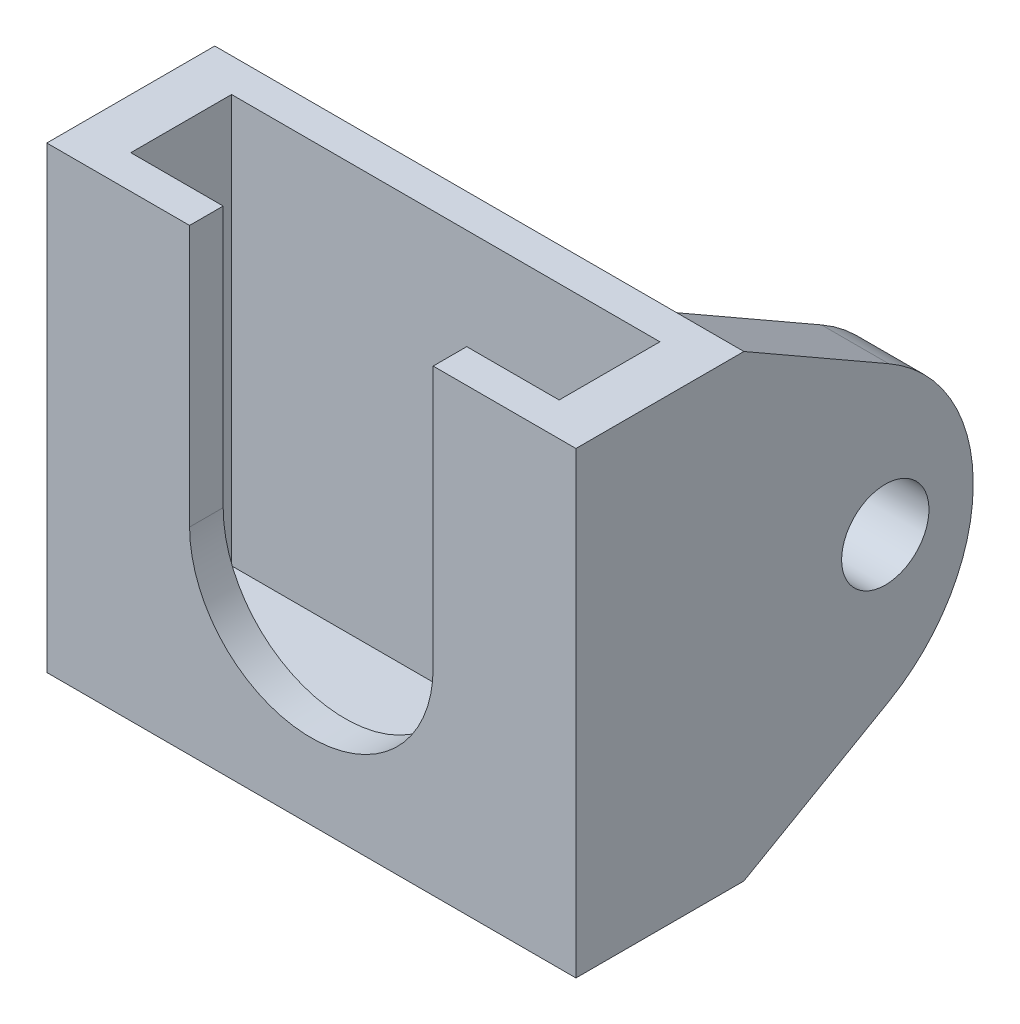
from build123d import *

# Parameters (mm, degrees)
SKETCH1_W           = 31.5
SKETCH1_H           = 30.3
SKETCH1_W_2         = 25.5
SKETCH1_H_2         = 24.3
BOSS_EXTRUDE1_DEPTH = 6
SKETCH2_W           = 31.5
SKETCH2_H           = 30.3
BOSS_EXTRUDE2_DEPTH = 2
CUT_EXTRUDE1_DEPTH  = 61
BOSS_EXTRUDE3_DEPTH = 2
SKETCH5_W           = 4
SKETCH5_H           = 27.3
BOSS_EXTRUDE4_DEPTH = 38
CUT_EXTRUDE2_DEPTH  = 38
SKETCH7_R           = 2.6
CUT_EXTRUDE3_DEPTH  = 38
CUT_EXTRUDE4_DEPTH  = 38
FILLET1_R           = 10


with BuildPart() as part:
    # Sketch1 → Boss-Extrude1 (new body)
    with BuildSketch(Plane.XY):
        with Locations((12.75, 12.15)):
            Rectangle(SKETCH1_W, SKETCH1_H)
        with Locations((12.75, 12.15)):
            Rectangle(SKETCH1_W_2, SKETCH1_H_2, mode=Mode.SUBTRACT)
    extrude(amount=BOSS_EXTRUDE1_DEPTH)

    # Sketch2 → Boss-Extrude2 (add)
    with BuildSketch(Plane(origin=(0, 0, 0), x_dir=(-1, 0, 0), z_dir=(0, 0, -1))):
        with Locations((-12.75, 12.15)):
            Rectangle(SKETCH2_W, SKETCH2_H)
    extrude(amount=BOSS_EXTRUDE2_DEPTH)

    # Sketch3 → Cut-Extrude1 (cut)
    with BuildSketch(Plane.XY.offset(6)):
        Polygon((-3, 24.391972576), (-3, 27.3), (28.5, 27.3), (28.5, 24.391972576), (28.5, 24.3), (0, 24.3), (-3, 24.3), align=None)
    extrude(amount=-CUT_EXTRUDE1_DEPTH, mode=Mode.SUBTRACT)

    # Sketch4 → Boss-Extrude3 (add)
    with BuildSketch(Plane.XY.offset(6)):
        with BuildLine():
            Line((-3, 24.3), (5.5, 24.3))
            Line((5.5, 24.3), (5.5, 8.75))
            ThreePointArc((5.5, 8.75), (12.75, 1.5), (20, 8.75))
            Line((20, 8.75), (20, 24.3))
            Line((20, 24.3), (28.5, 24.3))
            Line((28.5, 24.3), (28.5, -3))
            Line((28.5, -3), (-3, -3))
            Line((-3, -3), (-3, 24.3))
        make_face()
    extrude(amount=BOSS_EXTRUDE3_DEPTH)

    # Sketch5 → Boss-Extrude4 (add)
    with BuildSketch(Plane(origin=(0, 0, -2), x_dir=(-1, 0, 0), z_dir=(0, 0, -1))):
        with Locations((-26.5, 10.65)):
            Rectangle(SKETCH5_W, SKETCH5_H)
    extrude(amount=BOSS_EXTRUDE4_DEPTH)

    # Sketch6 → Cut-Extrude2 (cut)
    with BuildSketch(Plane.ZY.offset(-24.5)):
        with BuildLine():
            Line((-2, -3), (-40, -3))
            Line((-40, -3), (-40, 24.3))
            Line((-40, 24.3), (-2, 24.3))
            Line((-2, 24.3), (-17.826401454, 15.23386068))
            ThreePointArc((-17.826401454, 15.23386068), (-18.562622883, 14.501365189), (-18.832265792, 13.498437306))
            Line((-18.832265792, 13.498437306), (-18.832265792, 7.801562694))
            ThreePointArc((-18.832265792, 7.801562694), (-18.562622883, 6.798634811), (-17.826401454, 6.06613932))
            Line((-17.826401454, 6.06613932), (-2, -3))
        make_face()
    extrude(amount=-CUT_EXTRUDE2_DEPTH, mode=Mode.SUBTRACT)

    # Sketch7 → Cut-Extrude3 (cut)
    with BuildSketch(Plane.ZY.offset(-24.5)):
        with Locations(Location((-10.416132896, 10.65, 0), (0, 0, 270))):
            Circle(SKETCH7_R)
    extrude(amount=-CUT_EXTRUDE3_DEPTH, mode=Mode.SUBTRACT)

    # Sketch8 → Cut-Extrude4 (cut)
    with BuildSketch(Plane.ZY.offset(-24.5)):
        with BuildLine():
            ThreePointArc((-11.252656387, 0.614520451), (-15.36913817, 13.404749459), (-6.531723112, 23.52579068))
            Line((-6.531723112, 23.52579068), (-21.13731595, 18.385251799))
            Line((-21.13731595, 18.385251799), (-20.671768388, 0.766067146))
            Line((-20.671768388, 0.766067146), (-11.252656387, 0.614520451))
        make_face()
    extrude(amount=-CUT_EXTRUDE4_DEPTH, mode=Mode.SUBTRACT)

    # Fillet1
    fillet1_edges = [part.edges().sort_by_distance(p)[0] for p in [
        (26.5, 3.7451865, -13.774805753),
        (26.5, 17.5548135, -13.774805753),
    ]]
    fillet(fillet1_edges, radius=FILLET1_R)


solid = part.part
